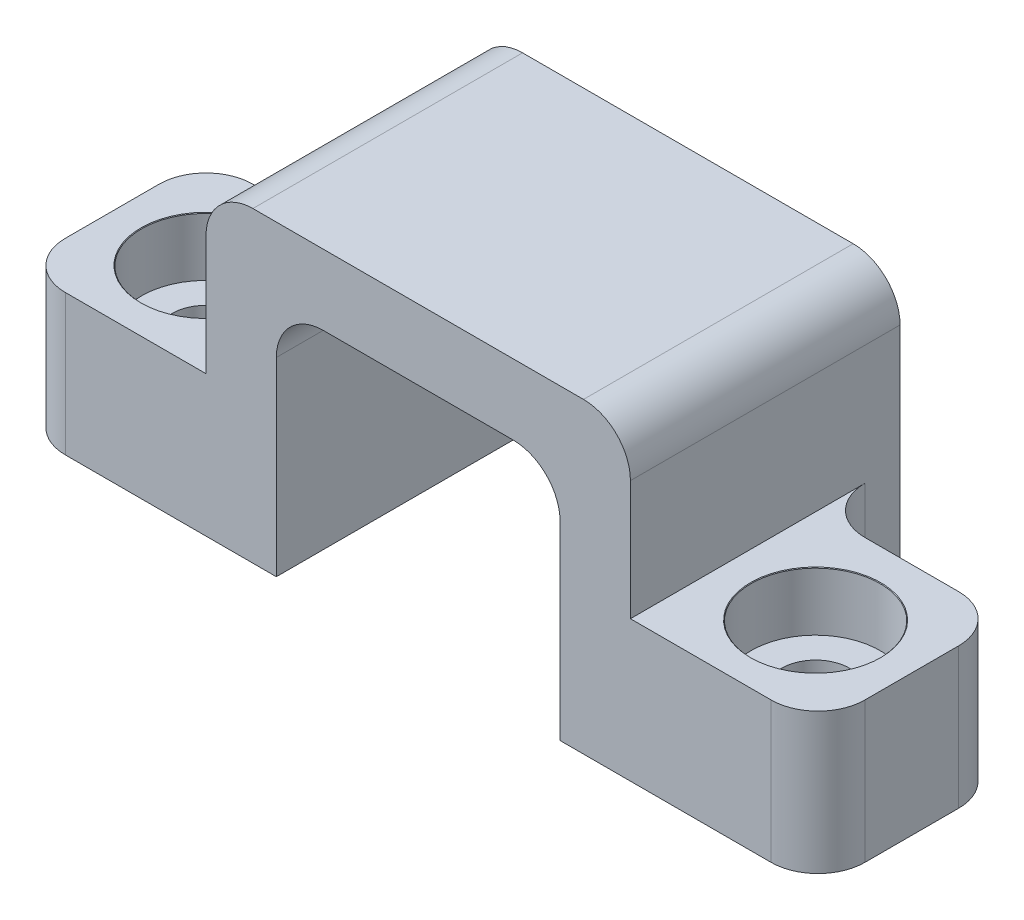
from build123d import *

# Parameters (mm, degrees)
BOSS_EXTRUDE1_DEPTH             = 11.5
SKETCH2_W                       = 8
SKETCH2_H                       = 6
BOSS_EXTRUDE2_DEPTH             = 8
CBORE_FOR_M2_5_SHCS1_AT_2_COUNT = 2
CBORE_FOR_M2_5_SHCS1_AT_2_PITCH = 26.100201416
FILLET2_R                       = 2


with BuildPart() as part:
    # Sketch1 → Boss-Extrude1 (new body)
    with BuildSketch(Plane.XY):
        Polygon((-9.05, 0), (-6.05, 0), (-6.05, 10.1), (6.05, 10.1), (6.05, 0), (9.05, 0), (9.05, 13.1), (-9.05, 13.1), align=None)
    extrude(amount=BOSS_EXTRUDE1_DEPTH)

    # Sketch2 → Boss-Extrude2 (add)
    with BuildSketch(Plane.XY.offset(11.5)):
        with Locations((-13.05, 3)):
            Rectangle(SKETCH2_W, SKETCH2_H)
        with Locations((13.05, 3)):
            Rectangle(SKETCH2_W, SKETCH2_H)
    extrude(amount=-BOSS_EXTRUDE2_DEPTH)

    # Sketch4 → CBORE for M2.5 SHCS1 (revolve, cut)
    with BuildSketch(Plane(origin=(-13.05, 6, 7.5), x_dir=(0, 0, 1), z_dir=(1, 0, 0))):
        Polygon((0, 0), (0, 6), (1.45, 6), (1.45, 2.5), (2.75, 2.5), (2.75, 0.025), (2.775, 0), align=None)
    cbore_for_m2_5_shcs1 = revolve(axis=Axis((-13.05, 12.35, 7.5), (0, -1, 0)), mode=Mode.SUBTRACT)

    # CBORE for M2.5 SHCS1 at 2: CBORE for M2.5 SHCS1 ×2
    with Locations(*[Vector(0.999992282957316, 0, 0.003928616272342698) * (i * CBORE_FOR_M2_5_SHCS1_AT_2_PITCH) for i in range(1, CBORE_FOR_M2_5_SHCS1_AT_2_COUNT)]):
        add(cbore_for_m2_5_shcs1, mode=Mode.SUBTRACT)

    # Fillet2
    fillet2_edges = [part.edges().sort_by_distance(p)[0] for p in [
        (-9.05, 13.1, 5.75),
        (9.05, 13.1, 5.75),
        (6.05, 10.1, 5.75),
        (-6.05, 10.1, 5.75),
        (-9.05, 3, 3.5),
        (-17.05, 3, 3.5),
        (-17.05, 3, 11.5),
        (9.05, 3, 3.5),
        (17.05, 3, 3.5),
        (17.05, 3, 11.5),
    ]]
    fillet(fillet2_edges, radius=FILLET2_R)


solid = part.part
